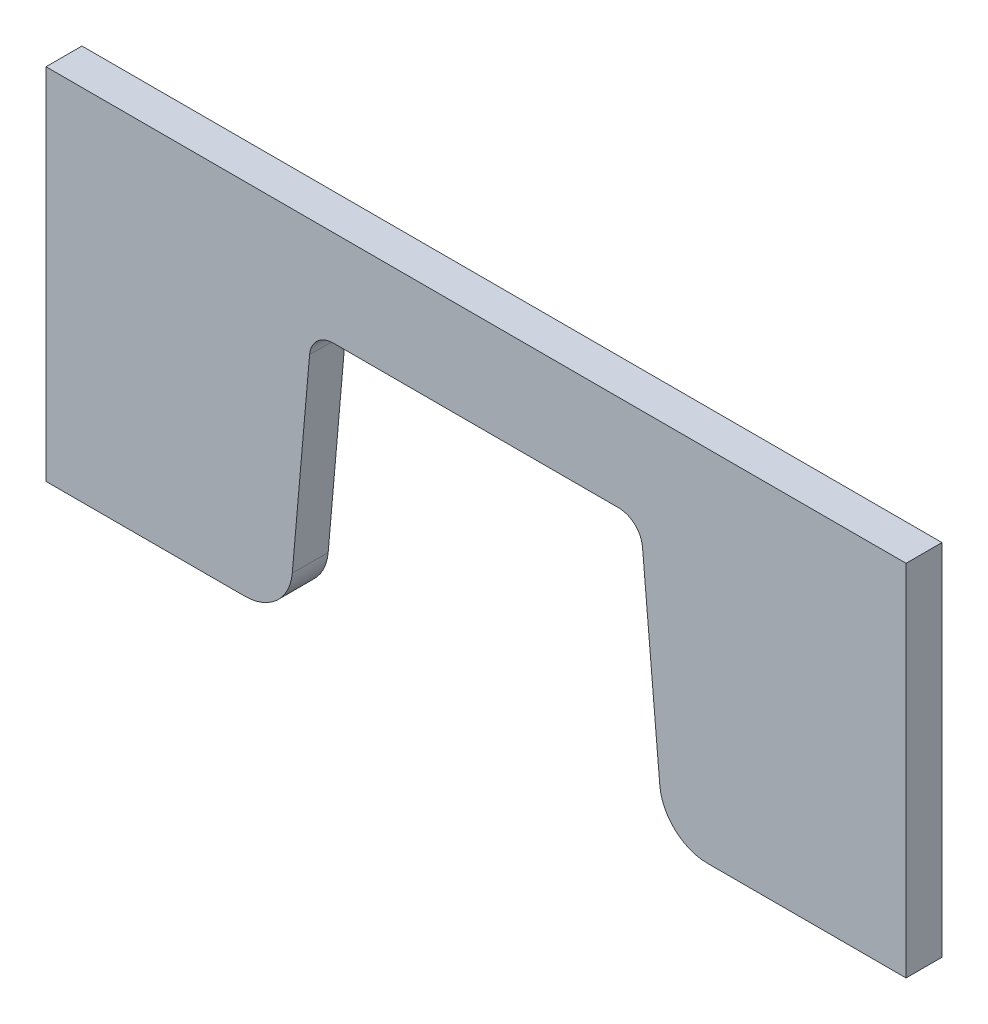
from build123d import *

# Parameters (mm, degrees)
BOSS_EXTRUDE1_DEPTH = 19.05


with BuildPart() as part:
    # Sketch1 → Boss-Extrude1 (new body)
    with BuildSketch(Plane.XY):
        with BuildLine():
            Line((-228.088766336, -463.55), (-126.488766336, -463.55))
            Line((-126.488766336, -463.55), (-122.776078156, -463.55))
            ThreePointArc((-122.776078156, -463.55), (-118.207935902, -463.135837515), (-113.788766336, -461.906856405))
            ThreePointArc((-113.788766336, -461.906856405), (-102.527903247, -453.485299567), (-97.472732825, -440.363755866))
            Line((-97.472732825, -440.363755866), (-88.289138704, -335.394794733))
            ThreePointArc((-88.289138704, -335.394794733), (-84.217461675, -327.138250488), (-75.637466038, -323.801672666))
            Line((-75.637466038, -323.801672666), (-61.874871948, -323.801672666))
            Line((-61.874871948, -323.801672666), (61.874871948, -323.801672666))
            Line((61.874871948, -323.801672666), (75.637466038, -323.801672666))
            ThreePointArc((75.637466038, -323.801672666), (84.217461675, -327.138250488), (88.289138704, -335.394794733))
            Line((88.289138704, -335.394794733), (97.472732825, -440.363755866))
            ThreePointArc((97.472732825, -440.363755866), (105.616086883, -456.876844355), (122.776078156, -463.55))
            Line((122.776078156, -463.55), (228.088766336, -463.55))
            Line((228.088766336, -463.55), (228.088766336, -273.05))
            Line((228.088766336, -273.05), (-228.088766336, -273.05))
            Line((-228.088766336, -273.05), (-228.088766336, -463.55))
        make_face()
    extrude(amount=BOSS_EXTRUDE1_DEPTH)


solid = part.part
